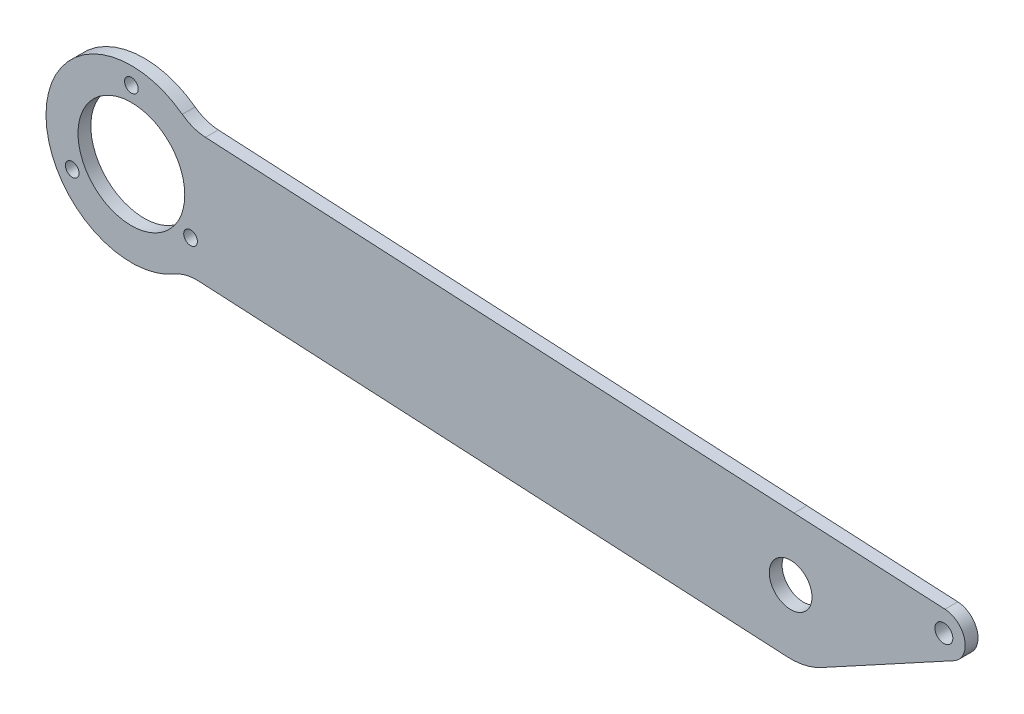
from build123d import *

# Parameters (mm, degrees)
SKETCH_1_R      = 5
SKETCH_1_R_2    = 2.1
SKETCH_1_R_3    = 1.6
SKETCH_1_R_4    = 12.5
EXTRUDE_1_DEPTH = 3
FILLET_1_R      = 10
FILLET_2_R      = 10


with BuildPart() as part:
    # 草图1 → 凸台-拉伸1 (new body)
    with BuildSketch(Plane.XY):
        with BuildLine():
            Line((12.419223494, -15.676826458), (153.603692908, -23.133474126))
            ThreePointArc((153.603692908, -23.133474126), (157.711237696, -22.783135564), (161.568286957, -21.32785817))
            Line((161.568286957, -21.32785817), (192.671157578, -4.391169028))
            ThreePointArc((192.671157578, -4.391169028), (195.155704471, 1.10792866), (190.538680801, 4.993303941))
            Line((190.538680801, 4.993303941), (155.185935535, 6.824771956))
            Line((155.185935535, 6.824771956), (14.001466121, 14.281419623))
            ThreePointArc((14.001466121, 14.281419623), (-19.972164054, 1.054828418), (12.419223494, -15.676826458))
        make_face()
        with Locations((154.394814221, -8.154351085)):
            Circle(SKETCH_1_R, mode=Mode.SUBTRACT)
        with Locations((190.28, 0)):
            Circle(SKETCH_1_R_2, mode=Mode.SUBTRACT)
        with Locations((0, 16)):
            Circle(SKETCH_1_R_3, mode=Mode.SUBTRACT)
        Circle(SKETCH_1_R_4, mode=Mode.SUBTRACT)
        with Locations((13.856406461, -8)):
            Circle(SKETCH_1_R_3, mode=Mode.SUBTRACT)
        with Locations((-13.856406461, -8)):
            Circle(SKETCH_1_R_3, mode=Mode.SUBTRACT)
    extrude(amount=EXTRUDE_1_DEPTH)

    # 圆角1
    fillet_1_edges = [part.edges().sort_by_distance(p)[0] for p in [
        (14.001466121, 14.281419623, 1.5),
    ]]
    fillet(fillet_1_edges, radius=FILLET_1_R)

    # 圆角2
    fillet_2_edges = [part.edges().sort_by_distance(p)[0] for p in [
        (12.419223494, -15.676826458, 1.5),
    ]]
    fillet(fillet_2_edges, radius=FILLET_2_R)


solid = part.part
